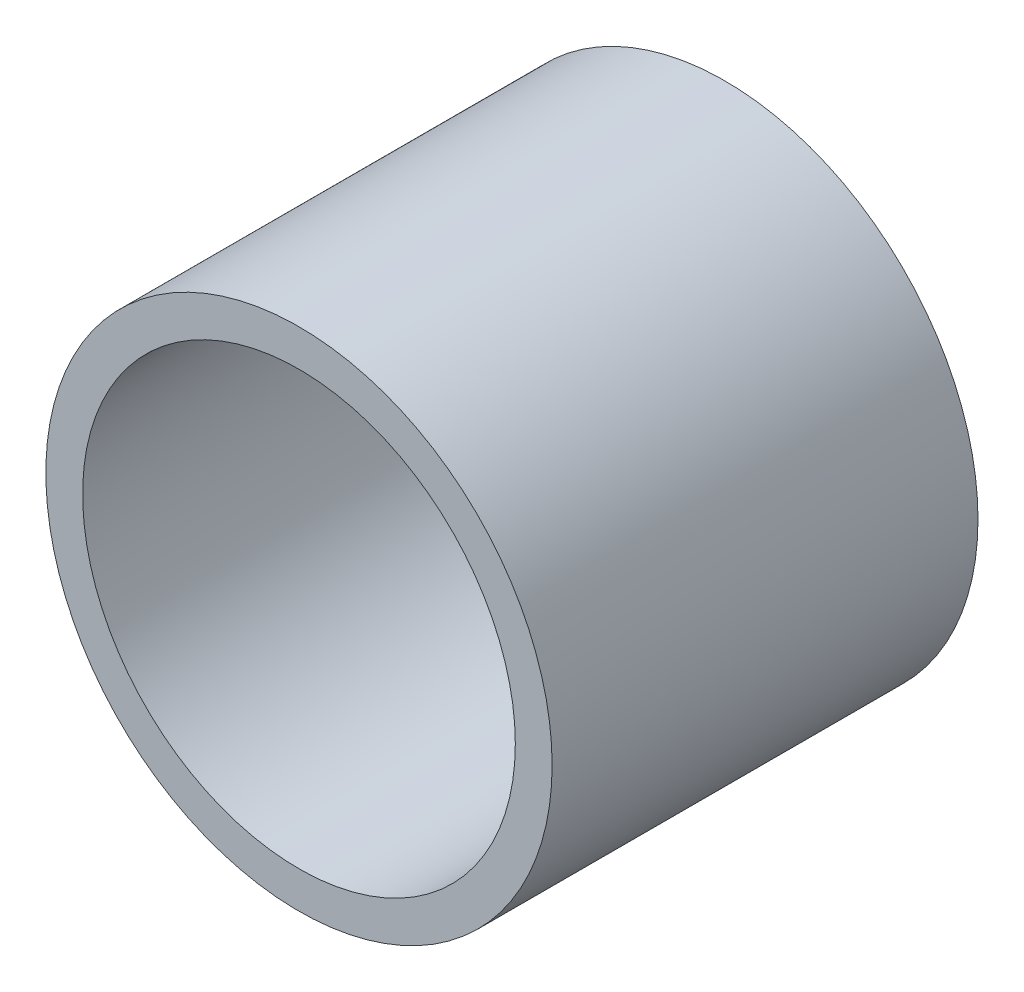
from build123d import *

# Parameters (mm, degrees)
CROQUIS1_R              = 29.72
CROQUIS1_R_2            = 25.4
SALIENTE_EXTRUIR1_DEPTH = 50


with BuildPart() as part:
    # Croquis1 → Saliente-Extruir1 (new body)
    with BuildSketch(Plane.XY):
        Circle(CROQUIS1_R)
        Circle(CROQUIS1_R_2, mode=Mode.SUBTRACT)
    extrude(amount=SALIENTE_EXTRUIR1_DEPTH)


solid = part.part
